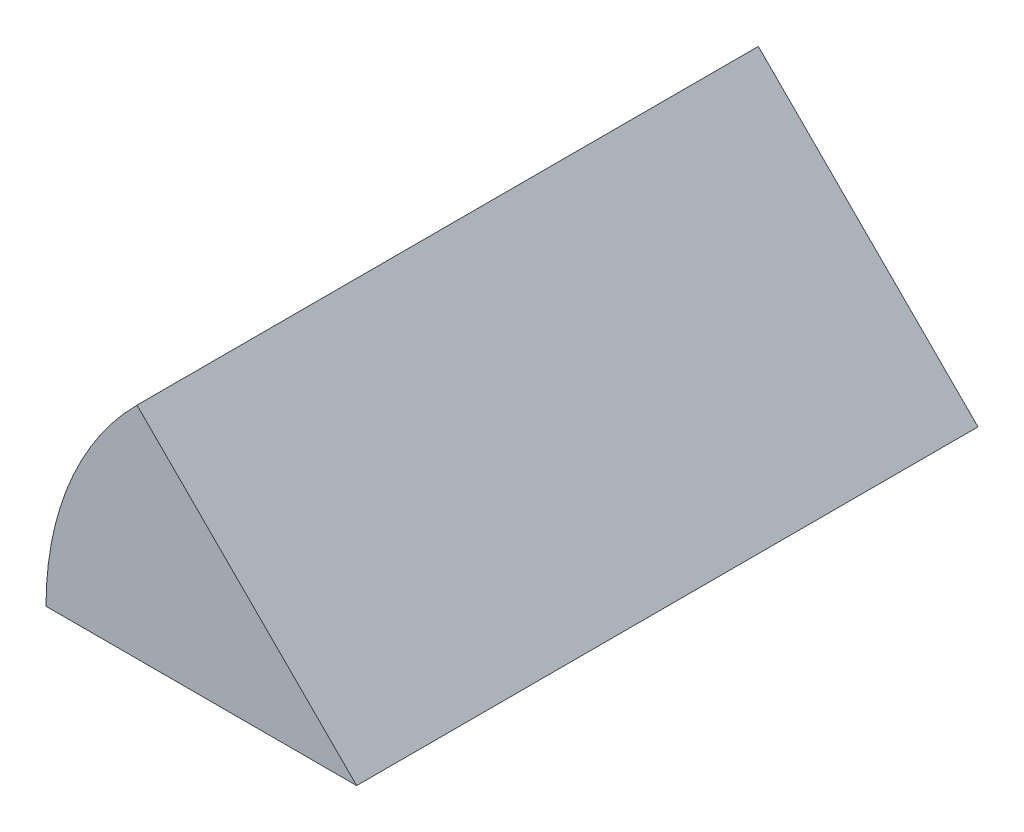
from build123d import *

# Parameters (mm, degrees)
SALIENTE_EXTRUIR1_DEPTH = 50
CROQUIS2_R              = 5
CORTAR_EXTRUIR1_DEPTH   = 10


with BuildPart() as part:
    # Croquis1 → Saliente-Extruir1 (new body)
    with BuildSketch(Plane.XY):
        with BuildLine():
            Line((-25, 0), (0, 0))
            Line((0, 0), (-17.67766953, 17.67766953))
            ThreePointArc((-17.67766953, 17.67766953), (-23.096988313, 9.567085809), (-25, 0))
        make_face()
    extrude(amount=SALIENTE_EXTRUIR1_DEPTH)

    # Croquis2 → Cortar-Extruir1 (cut)
    with BuildSketch(Plane(origin=(0, 0, 0), x_dir=(-1, 0, 0), z_dir=(0, 0, -1))):
        with Locations((16.497723615, 6.472535125)):
            Circle(CROQUIS2_R)
    extrude(amount=-CORTAR_EXTRUIR1_DEPTH, mode=Mode.SUBTRACT)


solid = part.part
